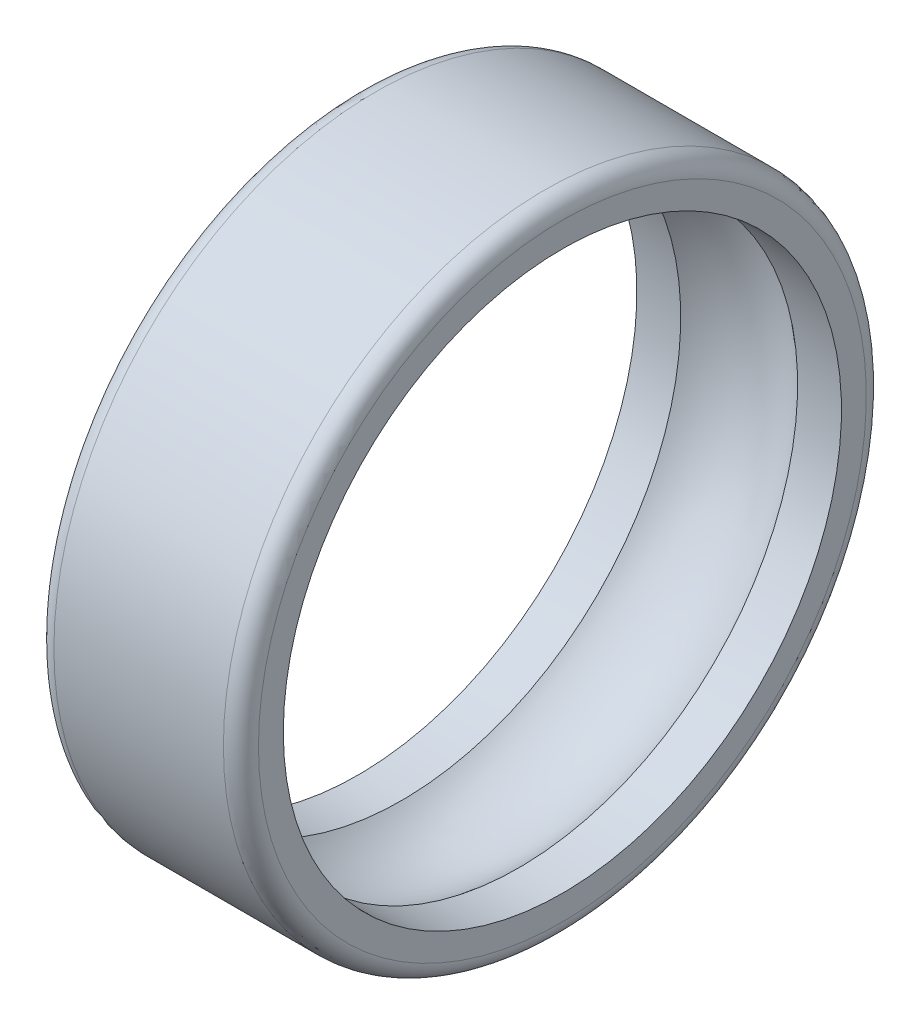
from build123d import *

# Parameters (mm, degrees)
RADYUS1_R = 0.6


with BuildPart() as part:
    # Çizim1 → Döndür1 (revolve)
    with BuildSketch(Plane.XY, mode=Mode.PRIVATE) as d_nd_r1_sk:
        with BuildLine():
            Line((-3.5, 11), (3.5, 11))
            Line((3.5, 11), (3.5, 9.55))
            Line((3.5, 9.55), (2, 9.55))
            ThreePointArc((2, 9.55), (0, 10.313932023), (-2, 9.55))
            Line((-2, 9.55), (-3.5, 9.55))
            Line((-3.5, 9.55), (-3.5, 11))
        make_face()
    revolve(d_nd_r1_sk.sketch.rotate(Axis((-13.551089688, 0, 0), (1, 0, 0)), 90), axis=Axis((-13.551089688, 0, 0), (1, 0, 0)))

    # Radyus1
    radyus1_edges = [part.edges().sort_by_distance(p)[0] for p in [
        (3.5, 0, -11),
        (-3.5, 0, -11),
    ]]
    fillet(radyus1_edges, radius=RADYUS1_R)


solid = part.part
